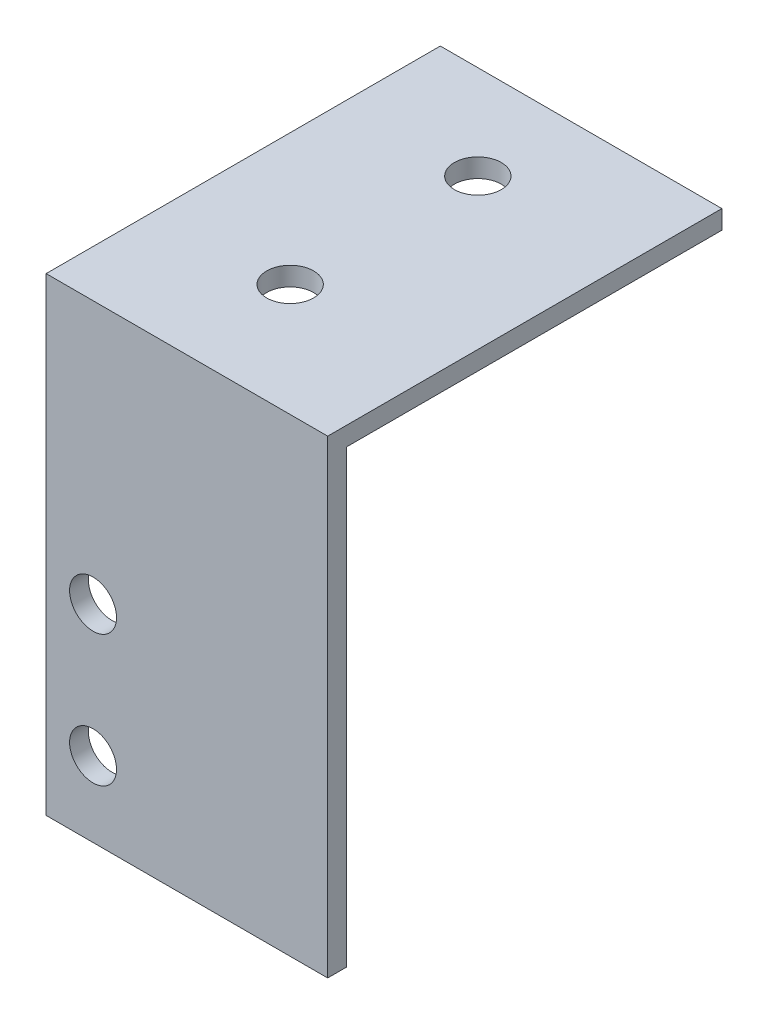
from build123d import *

# Parameters (mm, degrees)
SKETCH_1_W      = 15
SKETCH_1_H      = 25
EXTRUDE_1_DEPTH = 1
M3X0_5_1_D      = 2.5
M3X0_5_1_DEPTH  = 8.5
M3X0_5_1_TIP    = 0.751075774
SKETCH_4_W      = 15
SKETCH_4_H      = 1
EXTRUDE_2_DEPTH = 20
M3X0_5_2_D      = 2.5
M3X0_5_2_DEPTH  = 8.5
M3X0_5_2_TIP    = 0.751075774


with BuildPart() as part:
    # ｽｹｯﾁ1 → ﾎﾞｽ - 押し出し1 (new body)
    with BuildSketch(Plane.XY):
        with Locations((7.5, 12.5)):
            Rectangle(SKETCH_1_W, SKETCH_1_H)
    extrude(amount=EXTRUDE_1_DEPTH)

    # M3x0.5 ねじ穴1
    with Locations(Plane(origin=(0, 0, 0), x_dir=(-1, 0, 0), z_dir=(0, 0, -1))):
        with Locations((-2.5, 11), (-2.5, 4)):
            Hole(M3X0_5_1_D / 2, depth=M3X0_5_1_DEPTH)
            with Locations((0, 0, -(M3X0_5_1_DEPTH + M3X0_5_1_TIP / 2))):  # 118° drill point
                Cone(0, M3X0_5_1_D / 2, M3X0_5_1_TIP, mode=Mode.SUBTRACT)

    # ｽｹｯﾁ4 → ﾎﾞｽ - 押し出し2 (add)
    with BuildSketch(Plane(origin=(0, 0, 0), x_dir=(-1, 0, 0), z_dir=(0, 0, -1))):
        with Locations((-7.5, 24.5)):
            Rectangle(SKETCH_4_W, SKETCH_4_H)
    extrude(amount=EXTRUDE_2_DEPTH)

    # M3x0.5 ねじ穴2
    with Locations(Plane(origin=(0, 24, 0), x_dir=(-1, 0, 0), z_dir=(0, -1, 0))):
        with Locations((-7, 5), (-7, 15)):
            Hole(M3X0_5_2_D / 2, depth=M3X0_5_2_DEPTH)
            with Locations((0, 0, -(M3X0_5_2_DEPTH + M3X0_5_2_TIP / 2))):  # 118° drill point
                Cone(0, M3X0_5_2_D / 2, M3X0_5_2_TIP, mode=Mode.SUBTRACT)


solid = part.part
